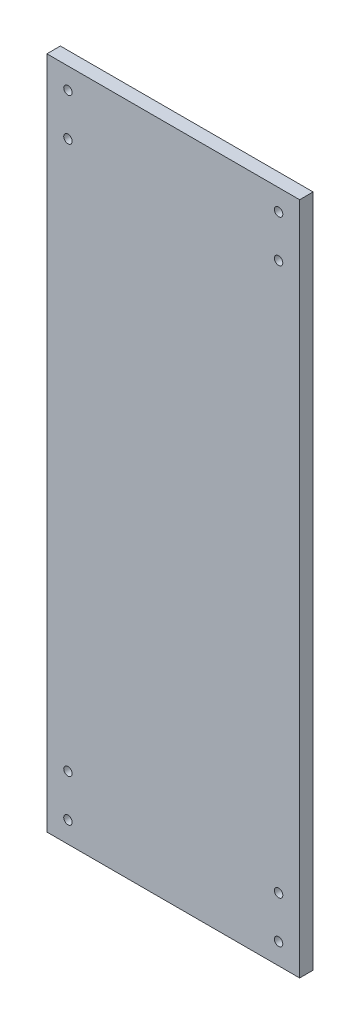
from build123d import *

# Parameters (mm, degrees)
MODEL_W             = 30
MODEL_H             = 80
MODEL_R             = 0.5
BOSS_EXTRUDE1_DEPTH = 1.6


with BuildPart() as part:
    # Model → Boss-Extrude1 (new body)
    with BuildSketch(Plane.XY):
        with Locations((127.096158615, 38.999999611)):
            Rectangle(MODEL_W, MODEL_H)
        with Locations((114.596158615, 6.499999611)):
            Circle(MODEL_R, mode=Mode.SUBTRACT)
        with Locations((114.596158615, 71.499999611)):
            Circle(MODEL_R, mode=Mode.SUBTRACT)
        with Locations((139.596158615, 6.499999611)):
            Circle(MODEL_R, mode=Mode.SUBTRACT)
        with Locations((139.596158615, 71.499999611)):
            Circle(MODEL_R, mode=Mode.SUBTRACT)
        with Locations((114.596158615, 76.499999611)):
            Circle(MODEL_R, mode=Mode.SUBTRACT)
        with Locations((139.596158615, 76.499999611)):
            Circle(MODEL_R, mode=Mode.SUBTRACT)
        with Locations((114.596158615, 1.499999611)):
            Circle(MODEL_R, mode=Mode.SUBTRACT)
        with Locations((139.596158615, 1.499999611)):
            Circle(MODEL_R, mode=Mode.SUBTRACT)
    extrude(amount=BOSS_EXTRUDE1_DEPTH)


solid = part.part
